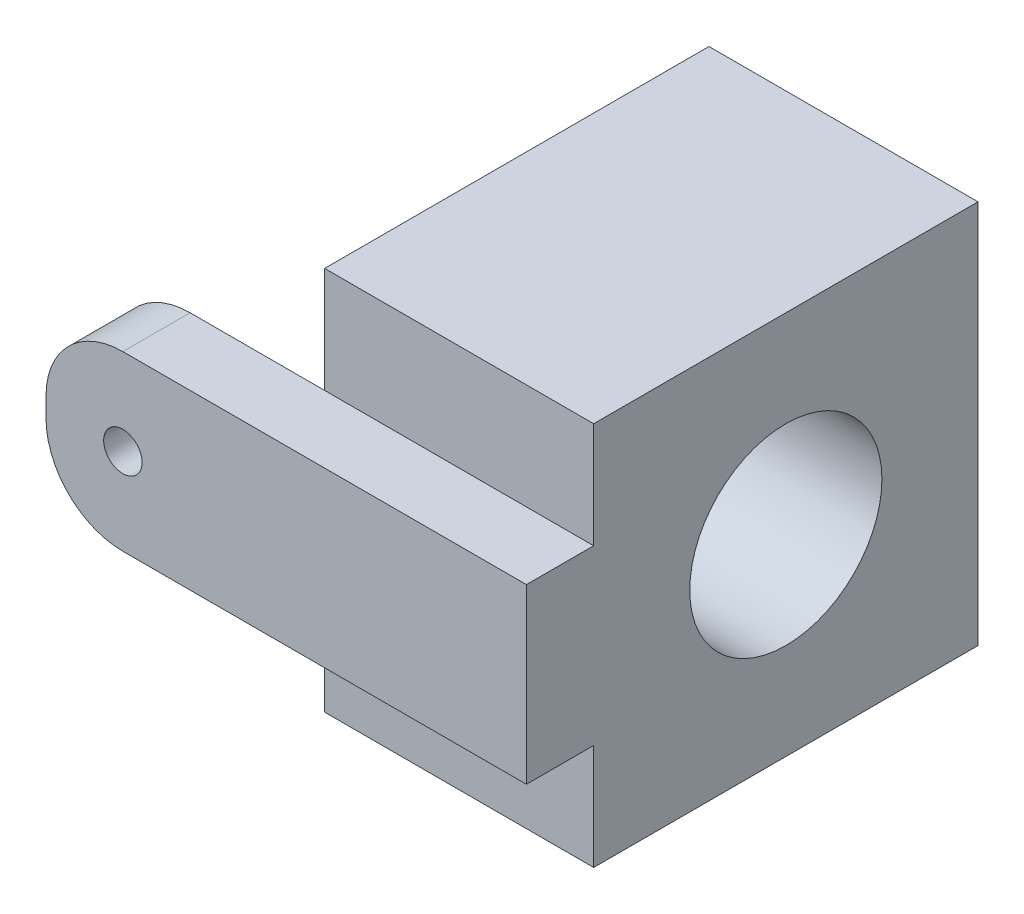
from build123d import *

# Parameters (mm, degrees)
AUFSATZ_LINEAR_AUSTRAGEN1_DEPTH      = 20
AUFSATZ_LINEAR_AUSTRAGEN1_DEPTH_BACK = 20
SKIZZE1_W                            = 28
SKIZZE1_H                            = 40
SKIZZE2_R                            = 10
SCHNITT_LINEAR_AUSTRAGEN1_DEPTH      = 40.799497484
SKIZZE3_W                            = 50
SKIZZE3_H                            = 18
AUFSATZ_LINEAR_AUSTRAGEN2_DEPTH      = 7
SKIZZE5_R                            = 2
SCHNITT_LINEAR_AUSTRAGEN2_DEPTH      = 63.4899992
VERRUNDUNG1_R                        = 8


with BuildPart() as part:
    # Skizze1 → Aufsatz-Linear austragen1 (new, two sides: drawn at the far end of the back side and taken through both)
    with BuildSketch(Plane(origin=(0, 0, 0), x_dir=(1, 0, 0), z_dir=(0, 1, 0)).offset(-AUFSATZ_LINEAR_AUSTRAGEN1_DEPTH_BACK)):
        Rectangle(SKIZZE1_W, SKIZZE1_H)
    extrude(amount=AUFSATZ_LINEAR_AUSTRAGEN1_DEPTH + AUFSATZ_LINEAR_AUSTRAGEN1_DEPTH_BACK)

    # Skizze2 → Schnitt-Linear austragen1 (cut, through all)
    with BuildSketch(Plane(origin=(14, 0, 0), x_dir=(0, 0, -1), z_dir=(1, 0, 0))):
        Circle(SKIZZE2_R)
    extrude(amount=-SCHNITT_LINEAR_AUSTRAGEN1_DEPTH, mode=Mode.SUBTRACT)

    # Skizze3 → Aufsatz-Linear austragen2 (add)
    with BuildSketch(Plane.XY.offset(20)):
        with Locations((-11, 0)):
            Rectangle(SKIZZE3_W, SKIZZE3_H)
    extrude(amount=AUFSATZ_LINEAR_AUSTRAGEN2_DEPTH)

    # Skizze5 → Schnitt-Linear austragen2 (cut, through all)
    with BuildSketch(Plane.XY.offset(27)):
        with Locations((-28, 0)):
            Circle(SKIZZE5_R)
    extrude(amount=-SCHNITT_LINEAR_AUSTRAGEN2_DEPTH, mode=Mode.SUBTRACT)

    # Verrundung1
    verrundung1_edges = [part.edges().sort_by_distance(p)[0] for p in [
        (-36, -9, 23.5),
        (-36, 9, 23.5),
    ]]
    fillet(verrundung1_edges, radius=VERRUNDUNG1_R)


solid = part.part
